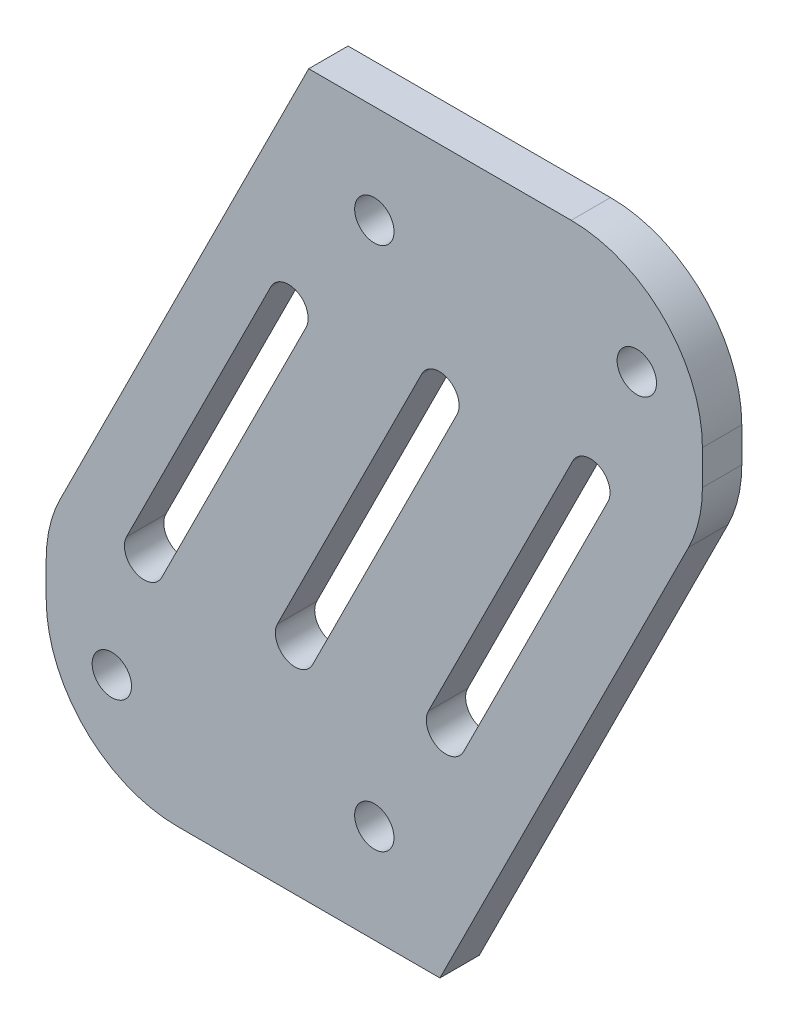
from build123d import *

# Parameters (mm, degrees)
EXTRUDE_1_DEPTH     = 3
SKETCH_3_R          = 1.5
CUT_EXTRUDE_1_DEPTH = 65.101482042
FILLET_2_R          = 10
FILLET_3_R          = 10
CUT_EXTRUDE_3_DEPTH = 65.101482042


with BuildPart() as part:
    # 草图2 → 凸台-拉伸1 (new body)
    with BuildSketch(Plane.XY):
        Polygon((0, 0), (0, 15), (-30, 15), (-50, -25), (-50, -40), (-20, -40), align=None)
    extrude(amount=EXTRUDE_1_DEPTH)

    # 草图3 → 切除-拉伸1 (cut, through all)
    with BuildSketch(Plane.XY.offset(3)):
        with Locations((-5, 7.5)):
            Circle(SKETCH_3_R)
        with Locations((-25, 7.5)):
            Circle(SKETCH_3_R)
        with Locations((-45, -32.5)):
            Circle(SKETCH_3_R)
        with Locations((-25, -32.5)):
            Circle(SKETCH_3_R)
    extrude(amount=-CUT_EXTRUDE_1_DEPTH, mode=Mode.SUBTRACT)

    # 圆角2
    fillet_2_edges = [part.edges().sort_by_distance(p)[0] for p in [
        (-50, -25, 1.5),
        (0, 0, 1.5),
    ]]
    fillet(fillet_2_edges, radius=FILLET_2_R)

    # 圆角3
    fillet_3_edges = [part.edges().sort_by_distance(p)[0] for p in [
        (-50, -40, 1.5),
        (0, 15, 1.5),
    ]]
    fillet(fillet_3_edges, radius=FILLET_3_R)

    # 草图7 → 切除-拉伸3 (cut, through all)
    with BuildSketch(Plane.XY.offset(3)):
        with BuildLine():
            Line((-43.883436854, -22.829179607), (-32.883436854, -0.829179607))
            ThreePointArc((-32.883436854, -0.829179607), (-30.870975674, -0.158359214), (-30.200155281, -2.170820393))
            Line((-30.200155281, -2.170820393), (-41.200155281, -24.170820393))
            ThreePointArc((-41.200155281, -24.170820393), (-43.212616461, -24.841640786), (-43.883436854, -22.829179607))
        make_face()
        with BuildLine():
            Line((-29.700155281, -24.170820393), (-18.700155281, -2.170820393))
            ThreePointArc((-18.700155281, -2.170820393), (-19.370975674, -0.158359214), (-21.383436854, -0.829179607))
            Line((-21.383436854, -0.829179607), (-32.383436854, -22.829179607))
            ThreePointArc((-32.383436854, -22.829179607), (-31.712616461, -24.841640786), (-29.700155281, -24.170820393))
        make_face()
        with BuildLine():
            Line((-18.200155281, -24.170820393), (-7.200155281, -2.170820393))
            ThreePointArc((-7.200155281, -2.170820393), (-7.870975674, -0.158359214), (-9.883436854, -0.829179607))
            Line((-9.883436854, -0.829179607), (-20.883436854, -22.829179607))
            ThreePointArc((-20.883436854, -22.829179607), (-20.212616461, -24.841640786), (-18.200155281, -24.170820393))
        make_face()
    extrude(amount=-CUT_EXTRUDE_3_DEPTH, mode=Mode.SUBTRACT)


solid = part.part
